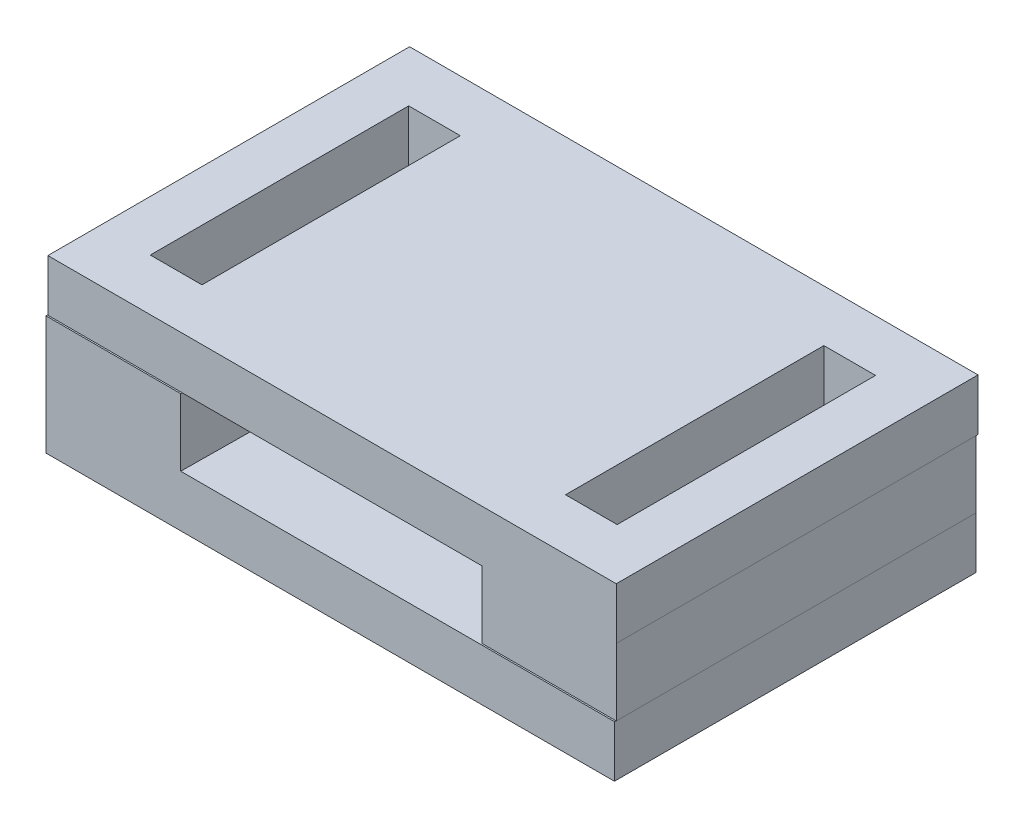
from build123d import *

# Parameters (mm, degrees)
SKETCH1_W           = 27.94
SKETCH1_H           = 17.78
SKETCH1_W_2         = 2.54
SKETCH1_H_2         = 12.7
BOSS_EXTRUDE2_DEPTH = 2.54
SKETCH3_R           = 1.27
BOSS_EXTRUDE3_DEPTH = 3.302
SKETCH6_W           = 2.503557337
SKETCH6_H           = 12.554229347
BOSS_EXTRUDE6_DEPTH = 3.302
SKETCH4_W           = 27.94
SKETCH4_H           = 17.78
SKETCH4_W_2         = 2.54
SKETCH4_H_2         = 12.7
BOSS_EXTRUDE7_DEPTH = 2.54


with BuildPart() as part:
    # Sketch1 → Boss-Extrude2 (new body)
    with BuildSketch(Plane(origin=(0, 0, 0), x_dir=(1, 0, 0), z_dir=(0, 1, 0))):
        Rectangle(SKETCH1_W, SKETCH1_H)
        with Locations((-10.20489899, 0)):
            Rectangle(SKETCH1_W_2, SKETCH1_H_2, mode=Mode.SUBTRACT)
        with Locations((10.20489899, 0)):
            Rectangle(SKETCH1_W_2, SKETCH1_H_2, mode=Mode.SUBTRACT)
    extrude(amount=BOSS_EXTRUDE2_DEPTH)

    # Sketch3 → Boss-Extrude3 (add)
    with BuildSketch(Plane(origin=(0, 2.54, 0), x_dir=(1, 0, 0), z_dir=(0, 1, 0))):
        with Locations(Location((-5.318941048, 2.54, 0), (0, 0, 90))):
            Circle(SKETCH3_R)
        with Locations(Location((5.318941048, 2.54, 0), (0, 0, 90))):
            Circle(SKETCH3_R)
    extrude(amount=BOSS_EXTRUDE3_DEPTH)

    # Sketch6 → Boss-Extrude6 (add)
    with BuildSketch(Plane(origin=(0, 2.54, 0), x_dir=(1, 0, 0), z_dir=(0, 1, 0))):
        Polygon((-7.215647318, 4.760339872), (7.384221332, 4.760339872), (7.384221332, -8.817114674), (13.988221332, -8.817114674), (13.97, 8.89), (-13.97, 8.89), (-13.97, -8.89), (-7.347778668, -8.89), align=None)
        with Locations((10.223120322, 0.072885327)):
            Rectangle(SKETCH6_W, SKETCH6_H, mode=Mode.SUBTRACT)
        with Locations((-10.186677659, 0.072885327)):
            Rectangle(SKETCH6_W, SKETCH6_H, mode=Mode.SUBTRACT)
    extrude(amount=BOSS_EXTRUDE6_DEPTH)

    # Sketch4 → Boss-Extrude7 (add)
    with BuildSketch(Plane(origin=(0, 5.842, 0), x_dir=(1, 0, 0), z_dir=(0, 1, 0))):
        with Locations((0.018221332, 0.072885326)):
            Rectangle(SKETCH4_W, SKETCH4_H)
        with Locations((-10.186677658, 0.072885326)):
            Rectangle(SKETCH4_W_2, SKETCH4_H_2, mode=Mode.SUBTRACT)
        with Locations((10.223120322, 0.072885326)):
            Rectangle(SKETCH4_W_2, SKETCH4_H_2, mode=Mode.SUBTRACT)
    extrude(amount=BOSS_EXTRUDE7_DEPTH)


solid = part.part
